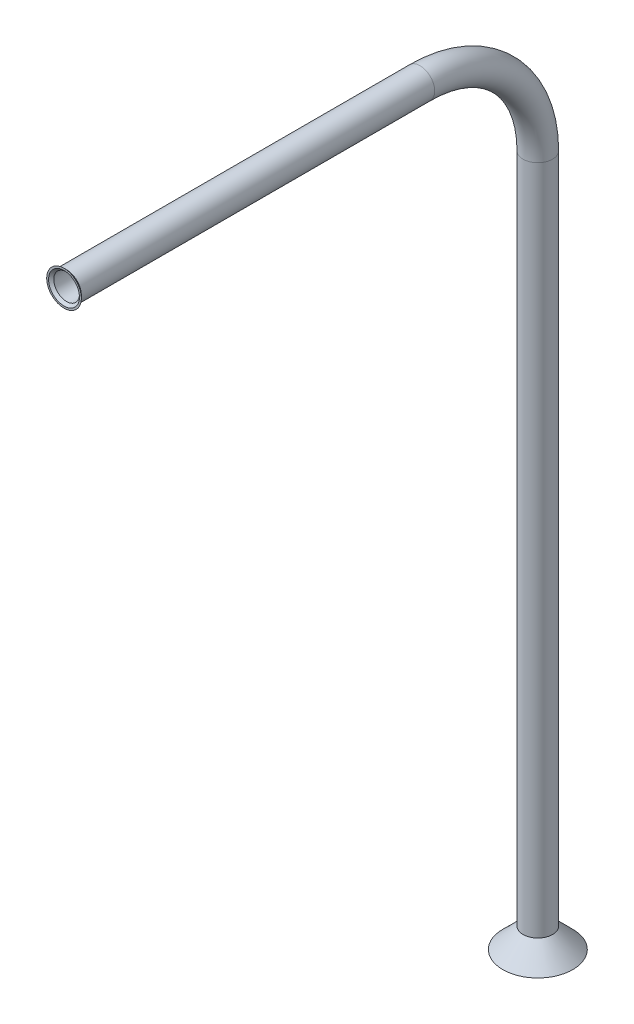
from build123d import *

# Parameters (mm, degrees)
SKETCH1_R   = 6.35
SKETCH1_R_2 = 5.5372


with BuildPart() as part:
    # Sweep1: sweep along a path in Sketch2
    with BuildLine(Plane(origin=(0, 0, 0), x_dir=(0, 0, -1), z_dir=(1, 0, 0))) as sweep1_path:
        Line((0, 0), (152.4, 0))
        ThreePointArc((152.4, 0), (188.321024484, -14.878975516), (203.2, -50.8))
        Line((203.2, -50.8), (203.2, -340.36))
    # Sketch1 → Sweep1 (sweep)
    with BuildSketch(Plane.XY):
        Circle(SKETCH1_R)
        Circle(SKETCH1_R_2, mode=Mode.SUBTRACT)
    sweep(path=sweep1_path.line)

    # Sketch3 → Revolve1 (revolve)
    with BuildSketch(Plane(origin=(0, 0, 0), x_dir=(0, 0, -1), z_dir=(1, 0, 0))):
        Polygon((0, 5.5372), (-1.122532015, 6.659732015), (-1.122532015, 7.472532015), (0, 6.35), align=None)
    revolve(axis=Axis((0, 0, -10.129320082), (0, 0, 1)))

    # Sketch4 → Revolve2 (revolve)
    with BuildSketch(Plane(origin=(0, 0, 0), x_dir=(0, 0, -1), z_dir=(1, 0, 0)), mode=Mode.PRIVATE) as revolve2_sk:
        Polygon((196.85, -340.36), (188.107467985, -349.102532015), (188.920267985, -349.102532015), (197.6628, -340.36), align=None)
    revolve(revolve2_sk.sketch.rotate(Axis((0, -309.261339279, -203.2), (0, -1, 0)), 180), axis=Axis((0, -309.261339279, -203.2), (0, -1, 0)))


solid = part.part
